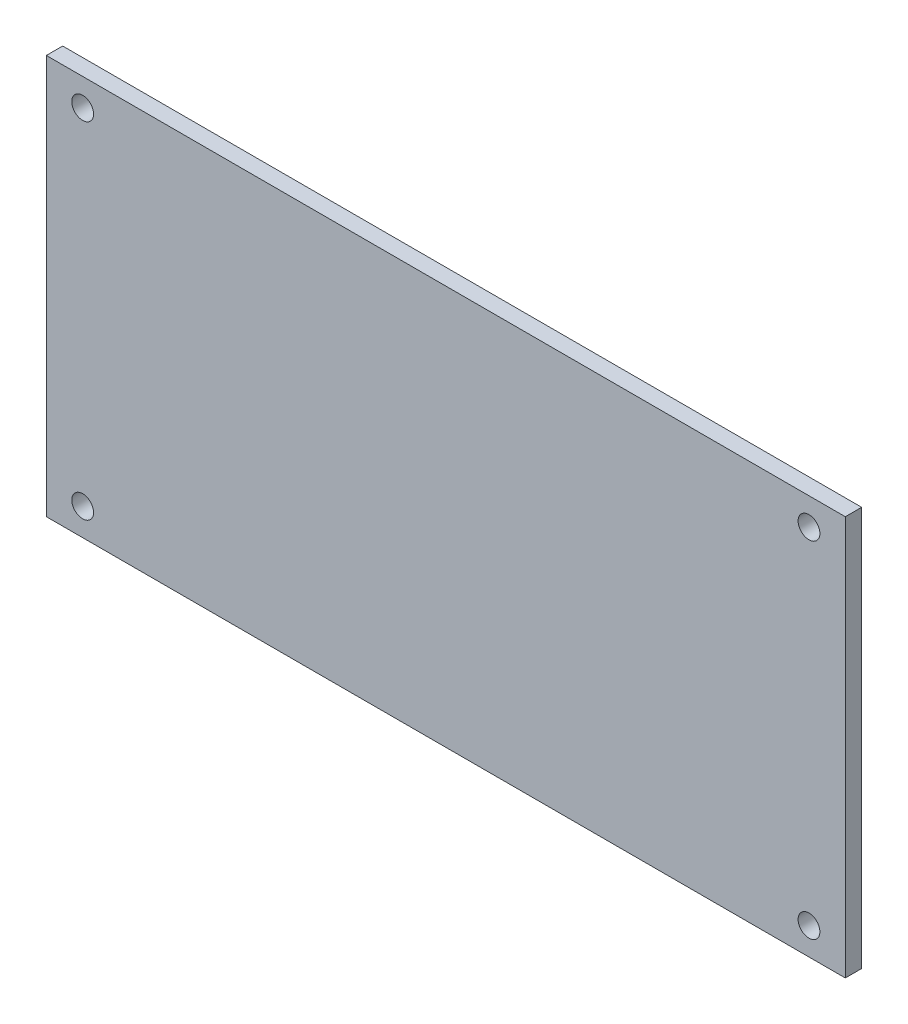
from build123d import *

# Parameters (mm, degrees)
SKETCH_1_W      = 110
SKETCH_1_H      = 55
SKETCH_1_R      = 1.5
EXTRUDE_1_DEPTH = 2.25


with BuildPart() as part:
    # Эскиз1 → Бобышка-Вытянуть1 (new body)
    with BuildSketch(Plane.XY):
        Rectangle(SKETCH_1_W, SKETCH_1_H)
        with Locations((-50, -23.75)):
            Circle(SKETCH_1_R, mode=Mode.SUBTRACT)
        with Locations((-50, 23.75)):
            Circle(SKETCH_1_R, mode=Mode.SUBTRACT)
        with Locations((50, -23.75)):
            Circle(SKETCH_1_R, mode=Mode.SUBTRACT)
        with Locations((50, 23.75)):
            Circle(SKETCH_1_R, mode=Mode.SUBTRACT)
    extrude(amount=EXTRUDE_1_DEPTH)


solid = part.part
